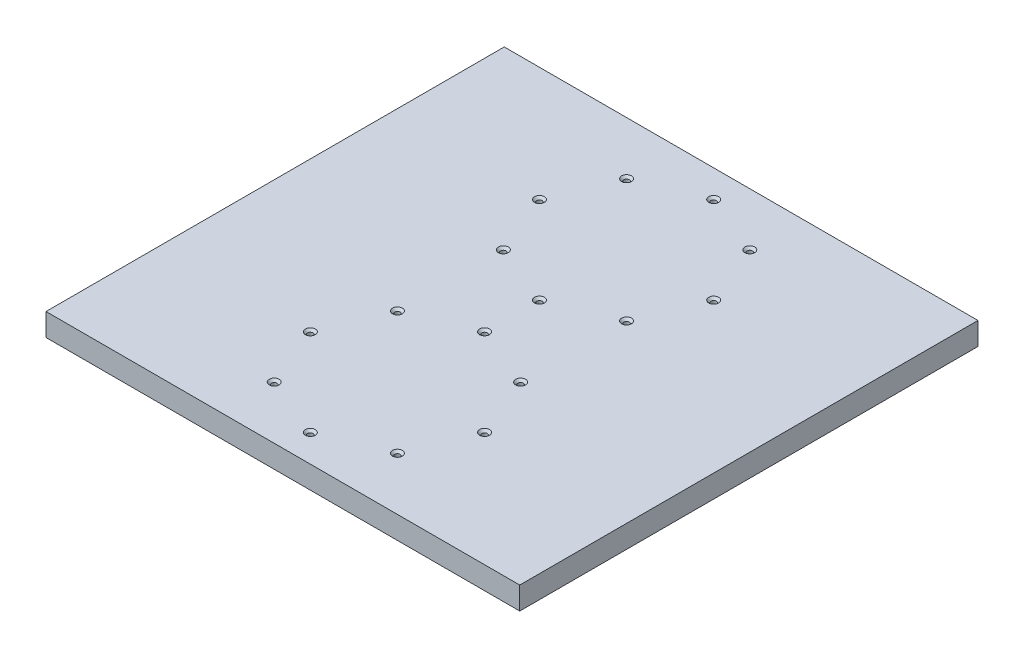
from build123d import *

# Parameters (mm, degrees)
SKETCH1_W                                       = 209.9860865
SKETCH1_H                                       = 101.561745788
BOSS_EXTRUDE1_DEPTH                             = 10
CSK_FOR_M2_FLAT_HEAD_MACHINE_SCREW1_D           = 2.4
CSK_FOR_M2_FLAT_HEAD_MACHINE_SCREW1_CSINK_D     = 4.4
CSK_FOR_M2_FLAT_HEAD_MACHINE_SCREW1_CSINK_ANGLE = 90
CIRPATTERN1_COUNT                               = 8
MIRROR1_COPY_1_D                                = 2.4
MIRROR1_COPY_1_CSINK_D                          = 4.4
MIRROR1_COPY_1_CSINK_ANGLE                      = 90
MIRROR1_COPY_2_D                                = 2.4
MIRROR1_COPY_2_CSINK_D                          = 4.4
MIRROR1_COPY_2_CSINK_ANGLE                      = 90
MIRROR1_COPY_3_D                                = 2.4
MIRROR1_COPY_3_CSINK_D                          = 4.4
MIRROR1_COPY_3_CSINK_ANGLE                      = 90
MIRROR1_COPY_4_D                                = 2.4
MIRROR1_COPY_4_CSINK_D                          = 4.4
MIRROR1_COPY_4_CSINK_ANGLE                      = 90
MIRROR1_COPY_5_D                                = 2.4
MIRROR1_COPY_5_CSINK_D                          = 4.4
MIRROR1_COPY_5_CSINK_ANGLE                      = 90
MIRROR1_COPY_6_D                                = 2.4
MIRROR1_COPY_6_CSINK_D                          = 4.4
MIRROR1_COPY_6_CSINK_ANGLE                      = 90
MIRROR1_COPY_7_D                                = 2.4
MIRROR1_COPY_7_CSINK_D                          = 4.4
MIRROR1_COPY_7_CSINK_ANGLE                      = 90


with BuildPart() as part:
    # Sketch1 → Boss-Extrude1 (new body)
    with BuildSketch(Plane(origin=(0, 0, 0), x_dir=(1, 0, 0), z_dir=(0, 1, 0))):
        Rectangle(SKETCH1_W, SKETCH1_H)
    boss_extrude1 = extrude(amount=BOSS_EXTRUDE1_DEPTH)

    # CSK for M2 Flat Head Machine Screw1 (through all)
    with Locations(Plane(origin=(-38.615809391, 10, 0), x_dir=(0, 0, 1), z_dir=(0, 1, 0))):
        with Locations((0, 0)):
            csk_for_m2_flat_head_machine_screw1 = CounterSinkHole(CSK_FOR_M2_FLAT_HEAD_MACHINE_SCREW1_D / 2, CSK_FOR_M2_FLAT_HEAD_MACHINE_SCREW1_CSINK_D / 2, counter_sink_angle=CSK_FOR_M2_FLAT_HEAD_MACHINE_SCREW1_CSINK_ANGLE)

    # CirPattern1: CSK for M2 Flat Head Machine Screw1 ×8 about axis
    cirpattern1_axis = Axis((0, 0, 0), (0, 1, 0))
    for i in range(1, CIRPATTERN1_COUNT):
        add(csk_for_m2_flat_head_machine_screw1.rotate(cirpattern1_axis, i * 360 / CIRPATTERN1_COUNT), mode=Mode.SUBTRACT)

    # Mirror1: Boss-Extrude1, CSK for M2 Flat Head Machine Screw1 across plane
    add(boss_extrude1.mirror(Plane(origin=(-104.99304325, 10, -50.780872894), x_dir=(1, 0, 0), z_dir=(0, 0, 1))))
    add(csk_for_m2_flat_head_machine_screw1.mirror(Plane(origin=(-104.99304325, 10, -50.780872894), x_dir=(1, 0, 0), z_dir=(0, 0, 1))), mode=Mode.SUBTRACT)

    # Mirror1 copy 1 (through all)
    with Locations(Plane(origin=(-27.305500681, 10, -128.867246469), x_dir=(0.7071067811865475, 0, -0.7071067811865476), z_dir=(0, 1, 0))):
        with Locations((0, 0)):
            CounterSinkHole(MIRROR1_COPY_1_D / 2, MIRROR1_COPY_1_CSINK_D / 2, counter_sink_angle=MIRROR1_COPY_1_CSINK_ANGLE)

    # Mirror1 copy 2 (through all)
    with Locations(Plane(origin=(0, 10, -140.177555179), x_dir=(1, 0, 0), z_dir=(0, 1, 0))):
        with Locations((0, 0)):
            CounterSinkHole(MIRROR1_COPY_2_D / 2, MIRROR1_COPY_2_CSINK_D / 2, counter_sink_angle=MIRROR1_COPY_2_CSINK_ANGLE)

    # Mirror1 copy 3 (through all)
    with Locations(Plane(origin=(27.305500681, 10, -128.867246469), x_dir=(0.7071067811865476, 0, 0.7071067811865475), z_dir=(0, 1, 0))):
        with Locations((0, 0)):
            CounterSinkHole(MIRROR1_COPY_3_D / 2, MIRROR1_COPY_3_CSINK_D / 2, counter_sink_angle=MIRROR1_COPY_3_CSINK_ANGLE)

    # Mirror1 copy 4 (through all)
    with Locations(Plane(origin=(38.615809391, 10, -101.561745788), x_dir=(0, 0, 1), z_dir=(0, 1, 0))):
        with Locations((0, 0)):
            CounterSinkHole(MIRROR1_COPY_4_D / 2, MIRROR1_COPY_4_CSINK_D / 2, counter_sink_angle=MIRROR1_COPY_4_CSINK_ANGLE)

    # Mirror1 copy 5 (through all)
    with Locations(Plane(origin=(27.305500681, 10, -74.256245106), x_dir=(-0.7071067811865475, 0, 0.7071067811865477), z_dir=(0, 1, 0))):
        with Locations((0, 0)):
            CounterSinkHole(MIRROR1_COPY_5_D / 2, MIRROR1_COPY_5_CSINK_D / 2, counter_sink_angle=MIRROR1_COPY_5_CSINK_ANGLE)

    # Mirror1 copy 6 (through all)
    with Locations(Plane(origin=(0, 10, -62.945936397), x_dir=(-1, 0, 0), z_dir=(0, 1, 0))):
        with Locations((0, 0)):
            CounterSinkHole(MIRROR1_COPY_6_D / 2, MIRROR1_COPY_6_CSINK_D / 2, counter_sink_angle=MIRROR1_COPY_6_CSINK_ANGLE)

    # Mirror1 copy 7 (through all)
    with Locations(Plane(origin=(-27.305500681, 10, -74.256245106), x_dir=(-0.7071067811865477, 0, -0.7071067811865474), z_dir=(0, 1, 0))):
        with Locations((0, 0)):
            CounterSinkHole(MIRROR1_COPY_7_D / 2, MIRROR1_COPY_7_CSINK_D / 2, counter_sink_angle=MIRROR1_COPY_7_CSINK_ANGLE)


solid = part.part
